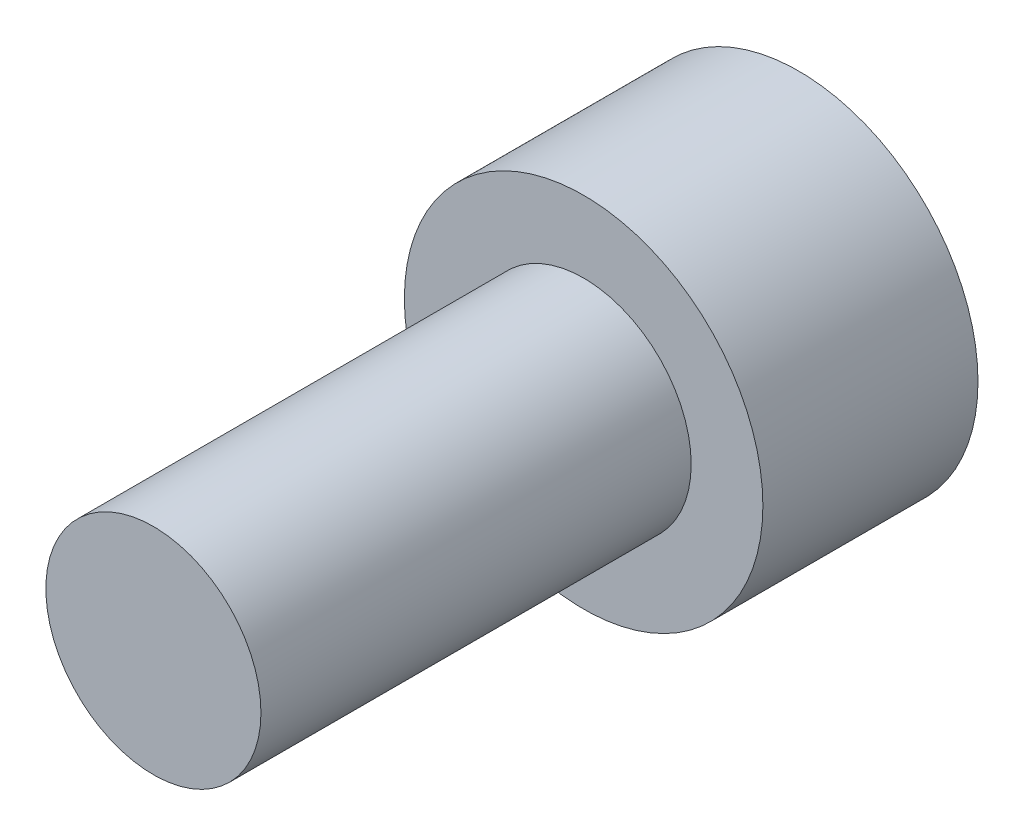
from build123d import *

# Parameters (mm, degrees)
CABEZA_START            = -6
CROQUIS1_R              = 5
CABEZA_DEPTH            = 6
CROQUIS2_R              = 3
CUERPO_DEPTH            = 12
HEXAGONO_INTERIOR_START = -6
HEXAGONO_INTERIOR_DEPTH = 3


with BuildPart() as part:
    # Croquis1 → Cabeza (new body)
    with BuildSketch(Plane.XY.offset(CABEZA_START)):
        Circle(CROQUIS1_R)
    extrude(amount=CABEZA_DEPTH)

    # Croquis2 → Cuerpo (add)
    with BuildSketch(Plane.XY):
        Circle(CROQUIS2_R)
    extrude(amount=CUERPO_DEPTH)

    # Croquis3 → Hexagono_interior (cut)
    with BuildSketch(Plane.XY.offset(HEXAGONO_INTERIOR_START)):
        Polygon((2.886751346, 0), (1.443375673, 2.5), (-1.443375673, 2.5), (-2.886751346, 0), (-1.443375673, -2.5), (1.443375673, -2.5), align=None)
    extrude(amount=HEXAGONO_INTERIOR_DEPTH, mode=Mode.SUBTRACT)


solid = part.part
